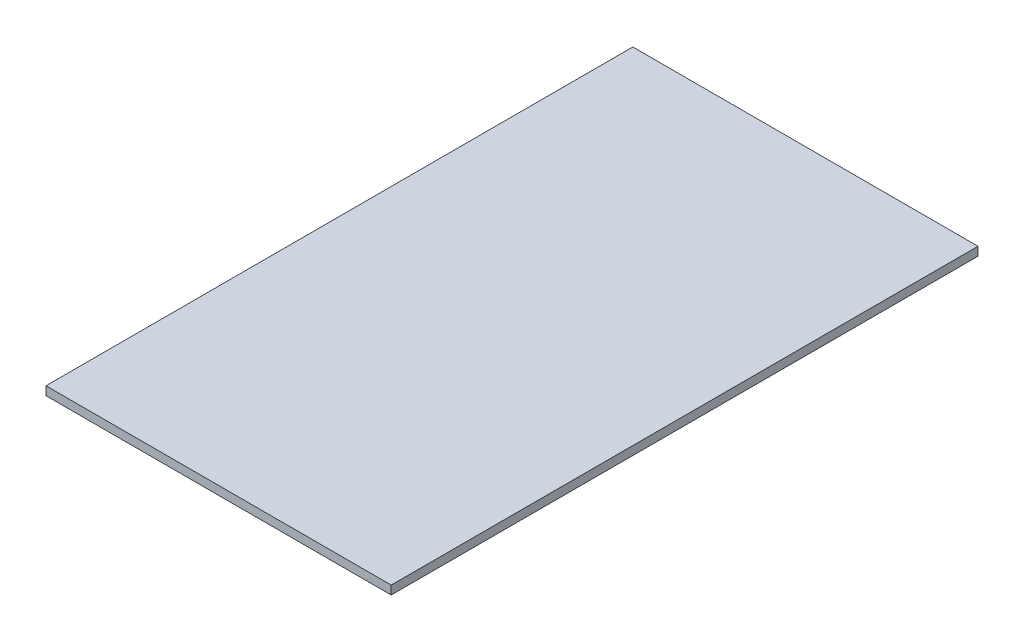
from build123d import *

# Parameters (mm, degrees)
SKETCH1_W           = 127
SKETCH1_H           = 215.9
BOSS_EXTRUDE1_DEPTH = 3.175


with BuildPart() as part:
    # Sketch1 → Boss-Extrude1 (new body)
    with BuildSketch(Plane(origin=(0, 0, 0), x_dir=(1, 0, 0), z_dir=(0, 1, 0))):
        with Locations((63.5, 107.95)):
            Rectangle(SKETCH1_W, SKETCH1_H)
    extrude(amount=BOSS_EXTRUDE1_DEPTH)


solid = part.part
